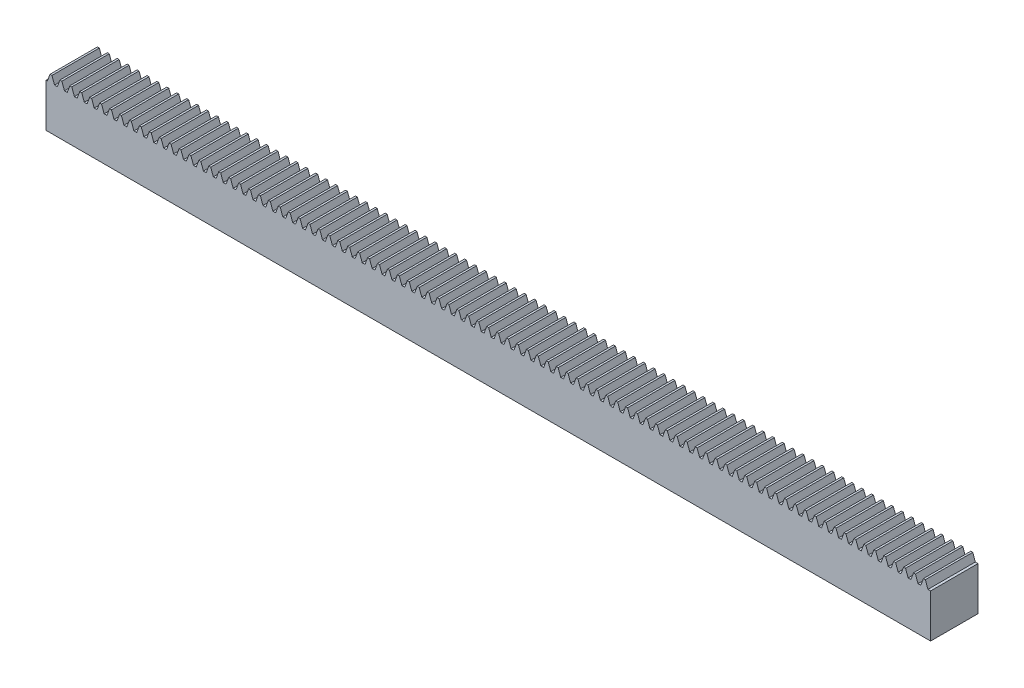
from build123d import *

# Parameters (mm, degrees)
BLANKSKE_W              = 280
BLANKSKE_H              = 16
BLANK_DEPTH             = 15
TOOTHCUTSIM_DEPTH       = 281.857615172
TEETHCUTS_COUNT         = 90
TEETHCUTS_PITCH         = 3.14159265
ESQUISSE3_R             = 1.25
ENL_V_MAT_EXTRU_3_DEPTH = 10


with BuildPart() as part:
    # BlankSke → Blank (new body)
    with BuildSketch(Plane.XY):
        with Locations((140, 8)):
            Rectangle(BLANKSKE_W, BLANKSKE_H)
    extrude(amount=-BLANK_DEPTH)

    # TooCutSkeSim → ToothCutSim (cut, through all)
    with BuildSketch(Plane.XY):
        Polygon((0.44443537, 13.75), (-0.44443537, 13.75), (-1.272613241, 16.0254), (1.272613241, 16.0254), align=None)
    toothcutsim = extrude(amount=-TOOTHCUTSIM_DEPTH, mode=Mode.SUBTRACT)

    # TeethCuts: ToothCutSim ×90
    with Locations(*[(i * TEETHCUTS_PITCH, 0, 0) for i in range(1, TEETHCUTS_COUNT)]):
        add(toothcutsim, mode=Mode.SUBTRACT)

    # Esquisse3 → Enlèv. mat.-Extru.3 (cut)
    with BuildSketch(Plane.XZ):
        with Locations(Location((19, -7.5, 0), (0, 0, 270))):
            Circle(ESQUISSE3_R)
        with Locations(Location((59, -7.5, 0), (0, 0, 270))):
            Circle(ESQUISSE3_R)
        with Locations(Location((99, -7.5, 0), (0, 0, 270))):
            Circle(ESQUISSE3_R)
        with Locations(Location((139, -7.5, 0), (0, 0, 270))):
            Circle(ESQUISSE3_R)
        with Locations(Location((179, -7.5, 0), (0, 0, 270))):
            Circle(ESQUISSE3_R)
        with Locations(Location((219, -7.5, 0), (0, 0, 270))):
            Circle(ESQUISSE3_R)
        with Locations(Location((259, -7.5, 0), (0, 0, 270))):
            Circle(ESQUISSE3_R)
    extrude(amount=-ENL_V_MAT_EXTRU_3_DEPTH, mode=Mode.SUBTRACT)


solid = part.part
